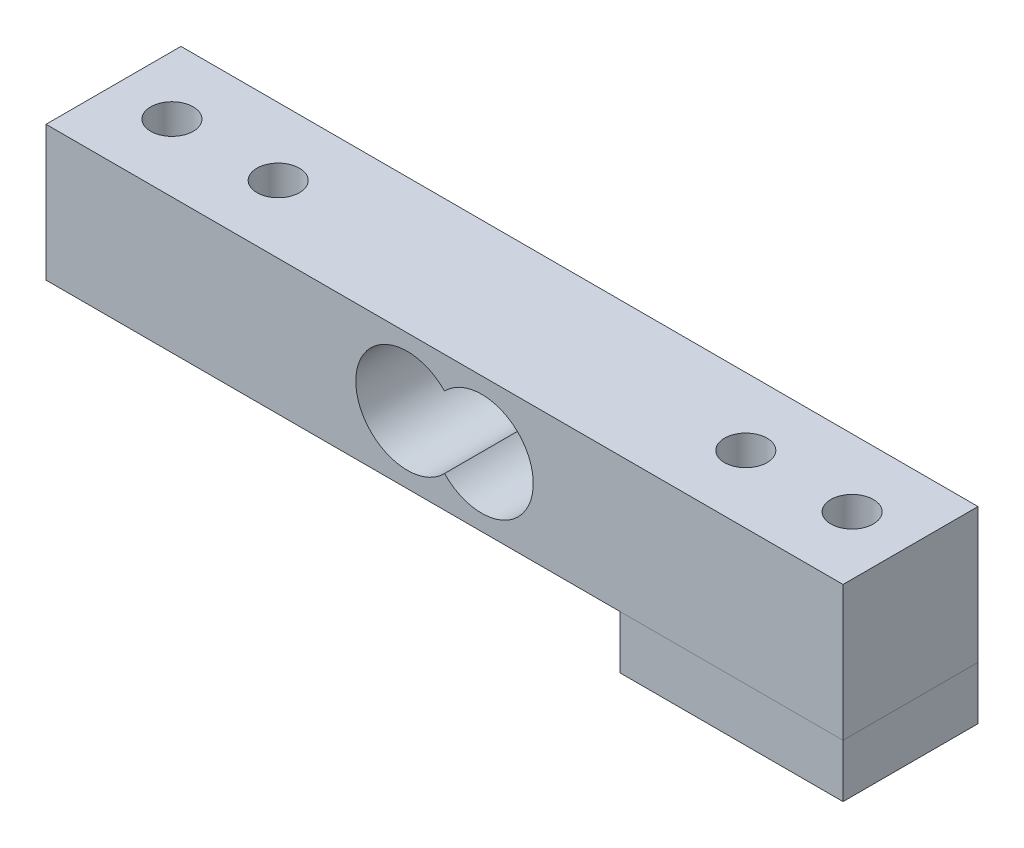
from build123d import *

# Parameters (mm, degrees)
SKETCH1_W           = 75
SKETCH1_H           = 12.7
SKETCH1_R           = 2
BOSS_EXTRUDE1_DEPTH = 12.7
SKETCH2_R           = 4.85
CUT_EXTRUDE1_DEPTH  = 12.7
SKETCH3_W           = 21
SKETCH3_H           = 12.7
SKETCH3_R           = 2.25
BOSS_EXTRUDE2_DEPTH = 5


with BuildPart() as part:
    # Sketch1 → Boss-Extrude1 (new body)
    with BuildSketch(Plane(origin=(0, 0, 0), x_dir=(1, 0, 0), z_dir=(0, 1, 0))):
        Rectangle(SKETCH1_W, SKETCH1_H)
        with Locations(Location((-32, 0, 0), (0, 0, 270))):
            Circle(SKETCH1_R, mode=Mode.SUBTRACT)
        with Locations(Location((-22, 0, 0), (0, 0, 270))):
            Circle(SKETCH1_R, mode=Mode.SUBTRACT)
        with Locations(Location((22, 0, 0), (0, 0, 270))):
            Circle(SKETCH1_R, mode=Mode.SUBTRACT)
        with Locations(Location((32, 0, 0), (0, 0, 270))):
            Circle(SKETCH1_R, mode=Mode.SUBTRACT)
    extrude(amount=BOSS_EXTRUDE1_DEPTH)

    # Sketch2 → Cut-Extrude1 (cut)
    with BuildSketch(Plane.XY.offset(6.35)):
        with Locations((3.5, 6.35)):
            Circle(SKETCH2_R)
        with Locations((-3.5, 6.35)):
            Circle(SKETCH2_R)
    extrude(amount=-CUT_EXTRUDE1_DEPTH, mode=Mode.SUBTRACT)


with BuildPart() as body_2:
    # Sketch3 → Boss-Extrude2 (new body)
    with BuildSketch(Plane.XZ):
        with Locations((27, 0)):
            Rectangle(SKETCH3_W, SKETCH3_H)
        with Locations(Location((32, 0, 0), (0, 0, 270))):
            Circle(SKETCH3_R, mode=Mode.SUBTRACT)
        with Locations(Location((22, 0, 0), (0, 0, 270))):
            Circle(SKETCH3_R, mode=Mode.SUBTRACT)
    extrude(amount=BOSS_EXTRUDE2_DEPTH)


solid = Compound([part.part, body_2.part])
